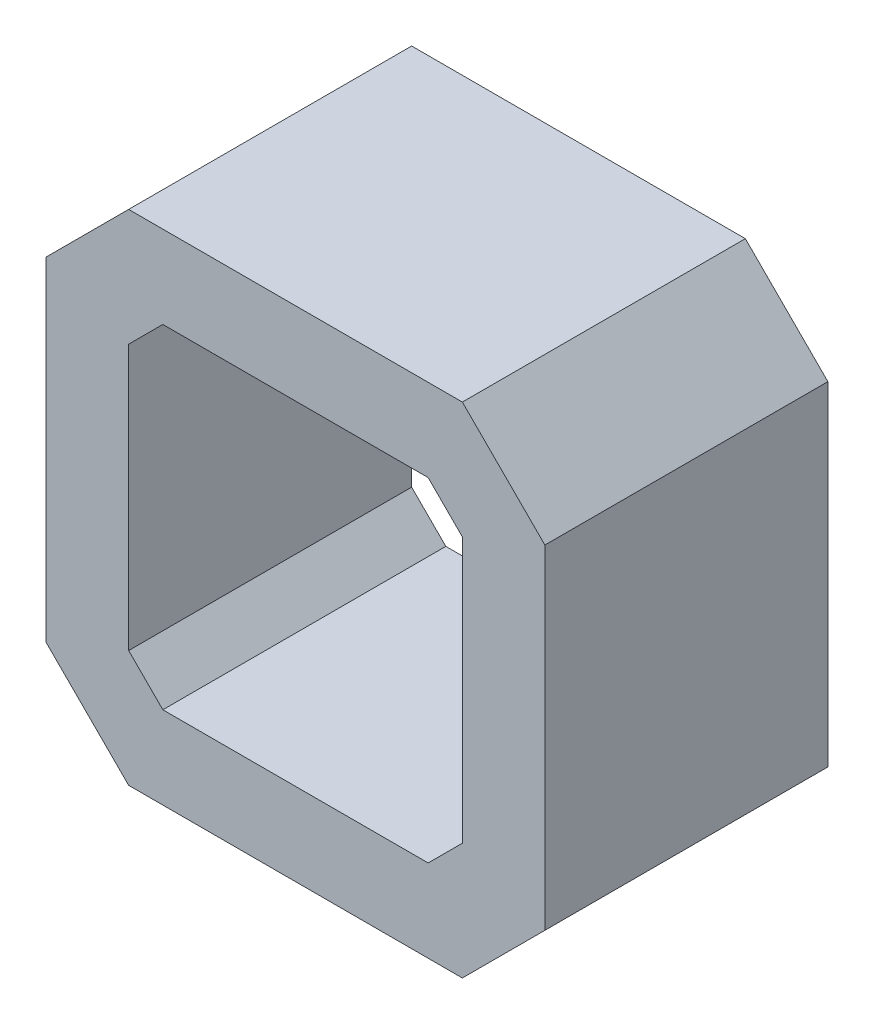
from build123d import *

# Parameters (mm, degrees)
SALIENTE_EXTRUIR1_DEPTH = 24
SHELL1_T                = -7


with BuildPart() as part:
    # Croquis1 → Saliente-Extruir1 (new body)
    with BuildSketch(Plane.XY):
        Polygon((-14.15, 21.15), (-21.15, 14.15), (-21.15, -14.15), (-14.15, -21.15), (14.15, -21.15), (21.15, -14.15), (21.15, 14.15), (14.15, 21.15), align=None)
    extrude(amount=SALIENTE_EXTRUIR1_DEPTH)

    # Shell1
    shell1_openings = [part.faces().sort_by_distance(p)[0] for p in [
        (0, 0, 24),
        (0, 0, 0),
    ]]
    offset(amount=SHELL1_T, openings=shell1_openings, kind=Kind.INTERSECTION)


solid = part.part
